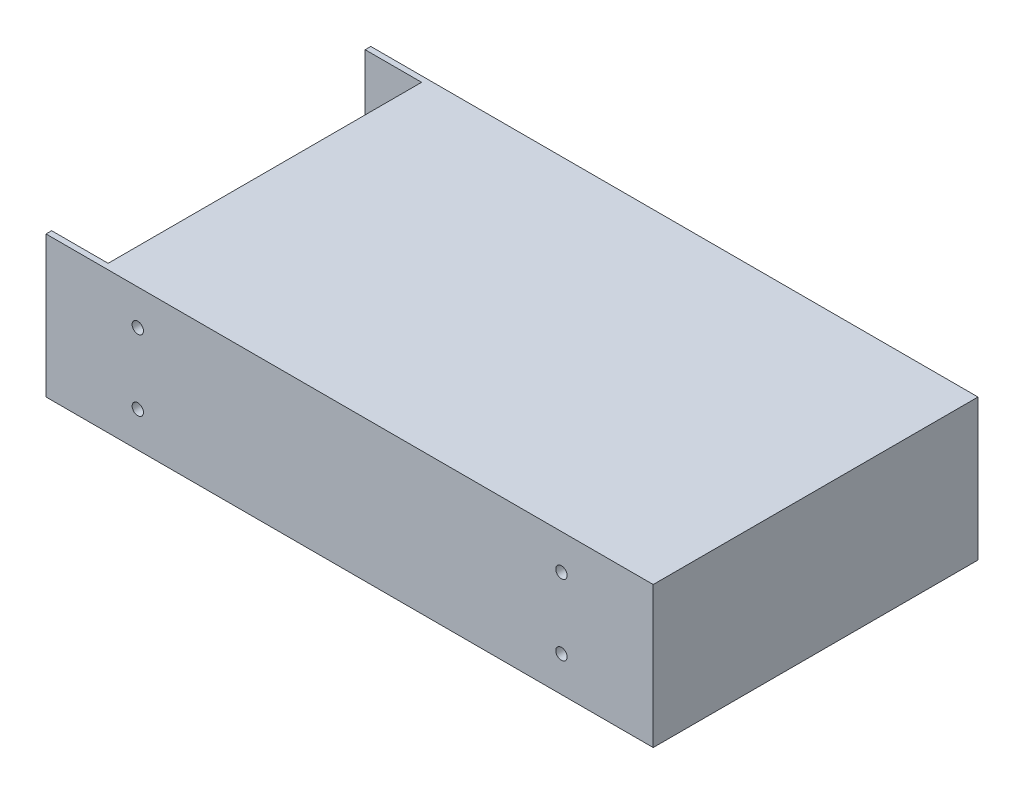
from build123d import *

# Parameters (mm, degrees)
SKETCH1_W           = 215
SKETCH1_H           = 115
BOSS_EXTRUDE1_DEPTH = 50
SKETCH2_W           = 20
SKETCH2_H           = 111
CUT_EXTRUDE1_DEPTH  = 30
SKETCH3_R           = 2
CUT_EXTRUDE2_DEPTH  = 5
SKETCH4_R           = 2
CUT_EXTRUDE3_DEPTH  = 3


with BuildPart() as part:
    # Sketch1 → Boss-Extrude1 (new body)
    with BuildSketch(Plane(origin=(0, 0, 0), x_dir=(1, 0, 0), z_dir=(0, 1, 0))):
        Rectangle(SKETCH1_W, SKETCH1_H)
    extrude(amount=BOSS_EXTRUDE1_DEPTH)

    # Sketch2 → Cut-Extrude1 (cut)
    with BuildSketch(Plane(origin=(0, 50, 0), x_dir=(1, 0, 0), z_dir=(0, 1, 0))):
        with Locations((-97.5, 0)):
            Rectangle(SKETCH2_W, SKETCH2_H)
    extrude(amount=-CUT_EXTRUDE1_DEPTH, mode=Mode.SUBTRACT)

    # Sketch3 → Cut-Extrude2 (cut)
    with BuildSketch(Plane.XZ):
        with Locations(Location((-75, 25, 0), (0, 0, 270))):
            Circle(SKETCH3_R)
        with Locations(Location((75, 25, 0), (0, 0, 270))):
            Circle(SKETCH3_R)
        with Locations(Location((75, -25, 0), (0, 0, 270))):
            Circle(SKETCH3_R)
        with Locations(Location((-75, -25, 0), (0, 0, 270))):
            Circle(SKETCH3_R)
    extrude(amount=-CUT_EXTRUDE2_DEPTH, mode=Mode.SUBTRACT)

    # Sketch4 → Cut-Extrude3 (cut)
    with BuildSketch(Plane.XY.offset(57.5)):
        with Locations((-75, 12.5)):
            Circle(SKETCH4_R)
        with Locations((-75, 37.5)):
            Circle(SKETCH4_R)
        with Locations((75, 37.5)):
            Circle(SKETCH4_R)
        with Locations((75, 12.5)):
            Circle(SKETCH4_R)
    extrude(amount=-CUT_EXTRUDE3_DEPTH, mode=Mode.SUBTRACT)


solid = part.part
